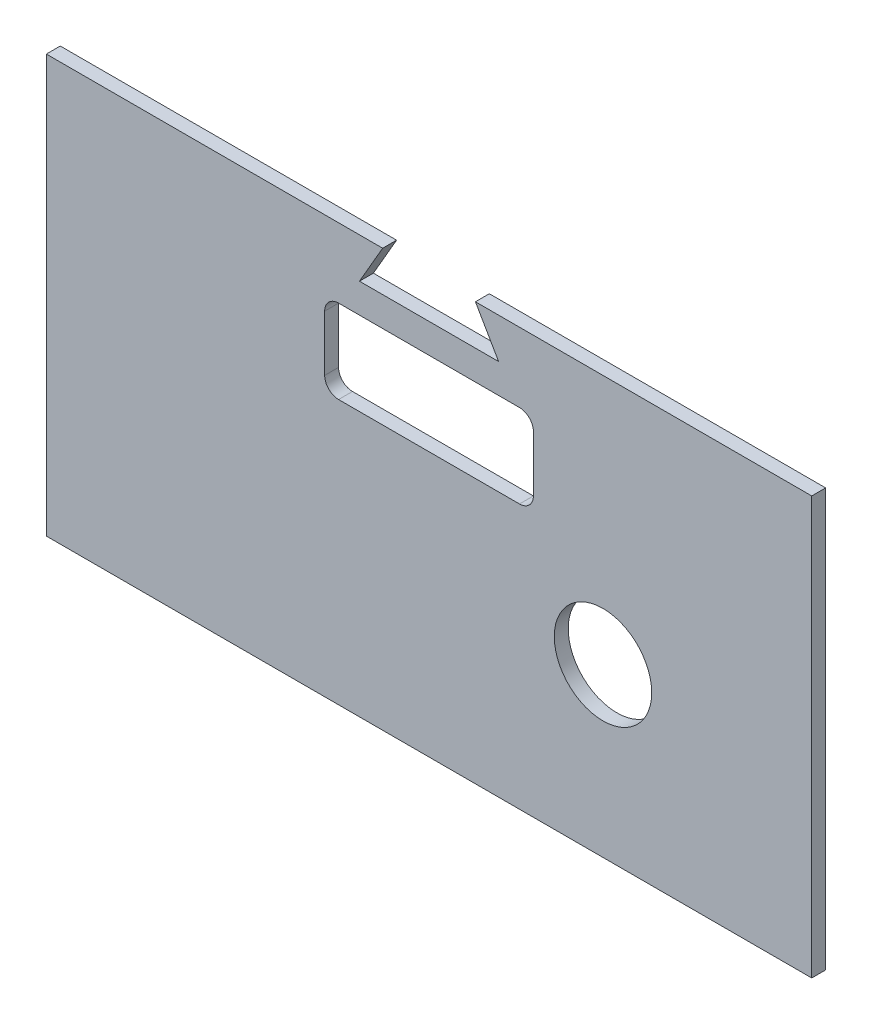
from build123d import *

# Parameters (mm, degrees)
SKETCH1_W               = 55
SKETCH1_H               = 30
BOSS_EXTRUDE1_DEPTH     = 1
CUT_EXTRUDE1_DEPTH      = 32.340867888
CUT_EXTRUDE1_DEPTH_BACK = 32.340867888
SKETCH2_R               = 3.5
SKETCH2_W               = 15
SKETCH2_H               = 6
FILLET1_R               = 1


with BuildPart() as part:
    # Sketch1 → Boss-Extrude1 (new body)
    with BuildSketch(Plane.XY):
        Rectangle(SKETCH1_W, SKETCH1_H)
    extrude(amount=BOSS_EXTRUDE1_DEPTH)

    # Sketch2 → Cut-Extrude1 (cut, two sides: drawn at the far end of the back side and taken through both)
    with BuildSketch(Plane.XY.offset(1).offset(-CUT_EXTRUDE1_DEPTH_BACK)):
        with Locations((12.5, -3)):
            Circle(SKETCH2_R)
        with Locations((0, 7)):
            Rectangle(SKETCH2_W, SKETCH2_H)
        Polygon((0, 20.773502692), (-5, 12.113248654), (5, 12.113248654), align=None)
    extrude(amount=CUT_EXTRUDE1_DEPTH + CUT_EXTRUDE1_DEPTH_BACK, mode=Mode.SUBTRACT)

    # Fillet1
    fillet1_edges = [part.edges().sort_by_distance(p)[0] for p in [
        (-7.5, 4, 0.5),
        (-7.5, 10, 0.5),
        (7.5, 10, 0.5),
        (7.5, 4, 0.5),
    ]]
    fillet(fillet1_edges, radius=FILLET1_R)


solid = part.part
